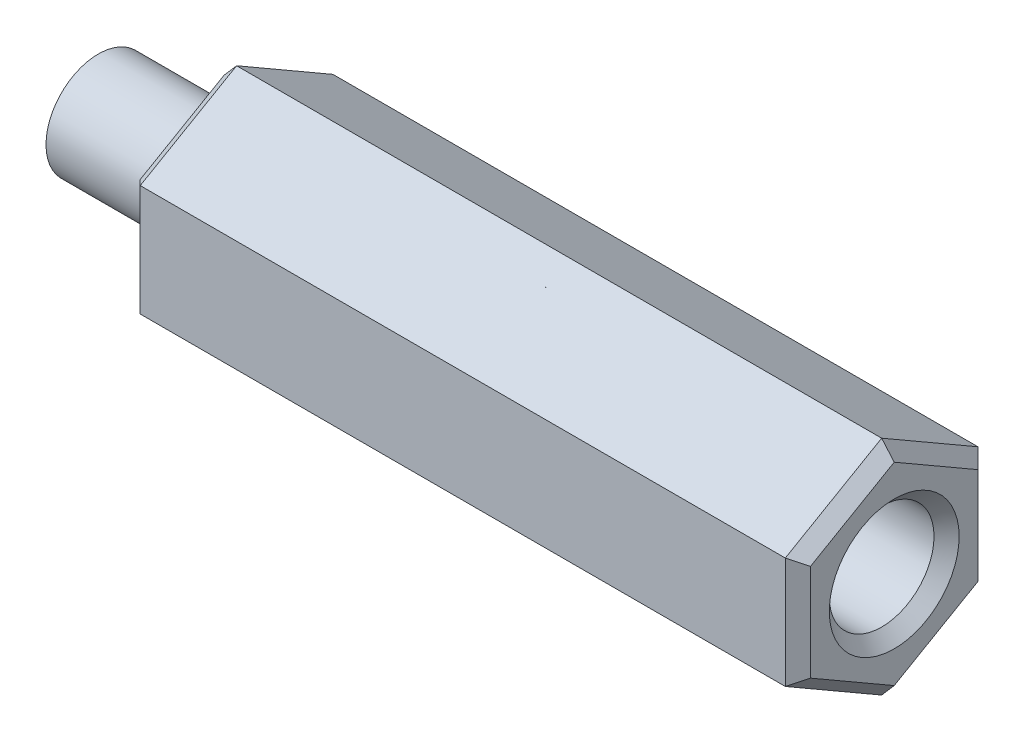
from build123d import *

# Parameters (mm, degrees)
SKETCH_1_R      = 1.25
EXTRUDE_1_DEPTH = 16
CHAMFER_1_SIZE  = 0.3
SKETCH_2_R      = 1.55
EXTRUDE_2_DEPTH = 2
EXTRUDE_START   = 3
SKETCH_3_R      = 1.25
EXTRUDE_3_DEPTH = 3


with BuildPart() as part:
    # 草图1 → 凸台-拉伸1 (new body)
    with BuildSketch(Plane.YZ):
        Polygon((2.655811238, 0), (1.327905619, 2.3), (-1.327905619, 2.3), (-2.655811238, 0), (-1.327905619, -2.3), (1.327905619, -2.3), align=None)
        with Locations(Location((0, 0, 0), (0, 0, 270))):
            Circle(SKETCH_1_R, mode=Mode.SUBTRACT)
    extrude(amount=EXTRUDE_1_DEPTH)

    # 倒角1
    chamfer_1_edges = [part.edges().sort_by_distance(p)[0] for p in [
        (16, 0, 2.3),
        (16, -1.991858429, 1.15),
        (0, 0, 1.25),
        (16, 0, 1.25),
        (16, -1.991858429, -1.15),
        (16, 0, -2.3),
        (16, 1.991858429, -1.15),
        (0, 0, -2.3),
        (0, -1.991858429, -1.15),
        (0, -1.991858429, 1.15),
        (0, 0, 2.3),
        (0, 1.991858429, 1.15),
        (0, 1.991858429, -1.15),
        (16, 1.991858429, 1.15),
    ]]
    chamfer(chamfer_1_edges, length=CHAMFER_1_SIZE)

    # 草图2 → 凸台-拉伸2 (add)
    with BuildSketch(Plane.ZY):
        Circle(SKETCH_2_R)
    extrude(amount=-EXTRUDE_2_DEPTH)

    # 草图3 → 凸台-拉伸3 (add)
    with BuildSketch(Plane.ZY.offset(EXTRUDE_START)):
        Circle(SKETCH_3_R)
    extrude(amount=-EXTRUDE_3_DEPTH)


solid = part.part
